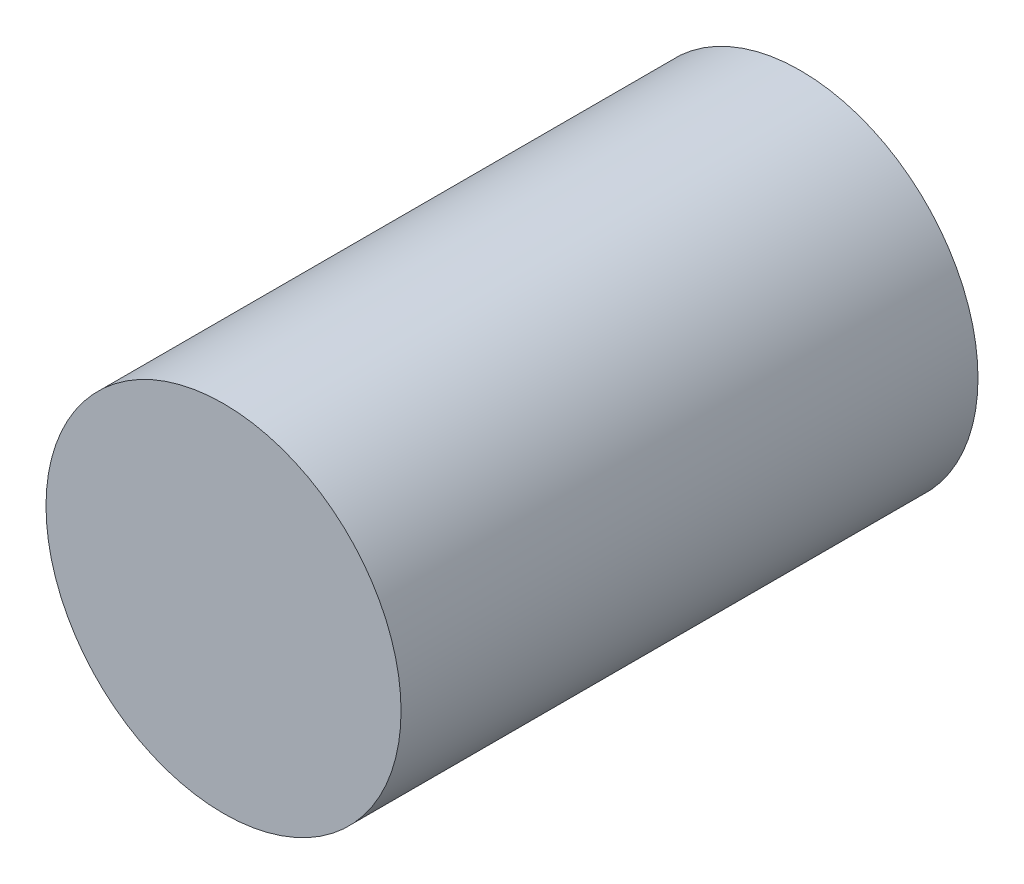
from build123d import *

# Parameters (mm, degrees)
SKETCH1_R     = 4
PROFILE_DEPTH = 13


with BuildPart() as part:
    # Sketch1 → Profile (new body)
    with BuildSketch(Plane.XY):
        with Locations(Location((4, 4, 0), (0, 0, 180))):
            Circle(SKETCH1_R)
    extrude(amount=PROFILE_DEPTH)


solid = part.part
